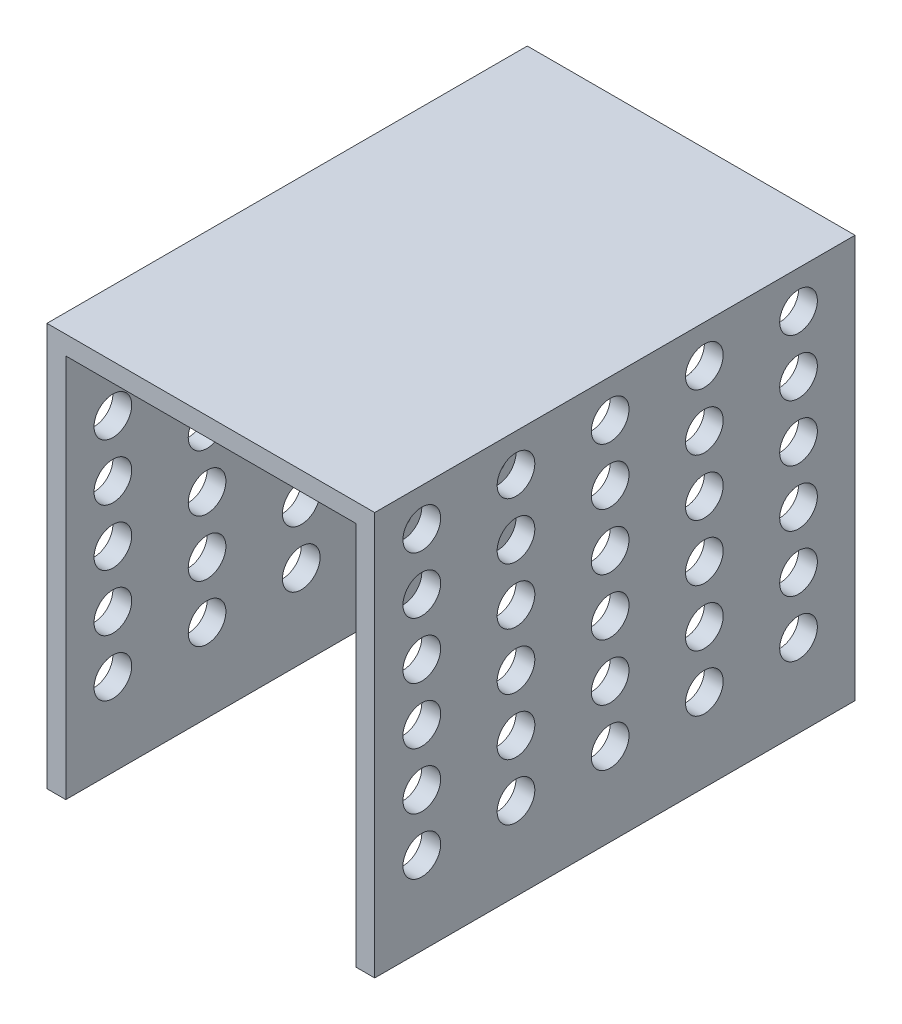
from build123d import *

# Parameters (mm, degrees)
EXTRUDE_1_DEPTH                   = 25.5
SKETCH_2_R                        = 1
CUT_EXTRUDE_1_DEPTH               = 27
PATTERN_LINEAR_1_COUNT            = 6
PATTERN_LINEAR_1_PITCH            = 3
PATTERN_LINEAR_2_COUNT            = 6
PATTERN_LINEAR_2_PITCH            = 5
PATTERN_LINEAR_2_COPY_1_SKETCH_R  = 1
PATTERN_LINEAR_2_COPY_1_DEPTH     = 27
PATTERN_LINEAR_2_COPY_2_SKETCH_R  = 1
PATTERN_LINEAR_2_COPY_2_DEPTH     = 27
PATTERN_LINEAR_2_COPY_3_SKETCH_R  = 1
PATTERN_LINEAR_2_COPY_3_DEPTH     = 27
PATTERN_LINEAR_2_COPY_4_SKETCH_R  = 1
PATTERN_LINEAR_2_COPY_4_DEPTH     = 27
PATTERN_LINEAR_2_COPY_5_SKETCH_R  = 1
PATTERN_LINEAR_2_COPY_5_DEPTH     = 27
PATTERN_LINEAR_2_COPY_6_SKETCH_R  = 1
PATTERN_LINEAR_2_COPY_6_DEPTH     = 27
PATTERN_LINEAR_2_COPY_7_SKETCH_R  = 1
PATTERN_LINEAR_2_COPY_7_DEPTH     = 27
PATTERN_LINEAR_2_COPY_8_SKETCH_R  = 1
PATTERN_LINEAR_2_COPY_8_DEPTH     = 27
PATTERN_LINEAR_2_COPY_9_SKETCH_R  = 1
PATTERN_LINEAR_2_COPY_9_DEPTH     = 27
PATTERN_LINEAR_2_COPY_10_SKETCH_R = 1
PATTERN_LINEAR_2_COPY_10_DEPTH    = 27
PATTERN_LINEAR_2_COPY_11_SKETCH_R = 1
PATTERN_LINEAR_2_COPY_11_DEPTH    = 27
PATTERN_LINEAR_2_COPY_12_SKETCH_R = 1
PATTERN_LINEAR_2_COPY_12_DEPTH    = 27
PATTERN_LINEAR_2_COPY_13_SKETCH_R = 1
PATTERN_LINEAR_2_COPY_13_DEPTH    = 27
PATTERN_LINEAR_2_COPY_14_SKETCH_R = 1
PATTERN_LINEAR_2_COPY_14_DEPTH    = 27
PATTERN_LINEAR_2_COPY_15_SKETCH_R = 1
PATTERN_LINEAR_2_COPY_15_DEPTH    = 27
PATTERN_LINEAR_2_COPY_16_SKETCH_R = 1
PATTERN_LINEAR_2_COPY_16_DEPTH    = 27
PATTERN_LINEAR_2_COPY_17_SKETCH_R = 1
PATTERN_LINEAR_2_COPY_17_DEPTH    = 27
PATTERN_LINEAR_2_COPY_18_SKETCH_R = 1
PATTERN_LINEAR_2_COPY_18_DEPTH    = 27
PATTERN_LINEAR_2_COPY_19_SKETCH_R = 1
PATTERN_LINEAR_2_COPY_19_DEPTH    = 27
PATTERN_LINEAR_2_COPY_20_SKETCH_R = 1
PATTERN_LINEAR_2_COPY_20_DEPTH    = 27
PATTERN_LINEAR_2_COPY_21_SKETCH_R = 1
PATTERN_LINEAR_2_COPY_21_DEPTH    = 27
PATTERN_LINEAR_2_COPY_22_SKETCH_R = 1
PATTERN_LINEAR_2_COPY_22_DEPTH    = 27
PATTERN_LINEAR_2_COPY_23_SKETCH_R = 1
PATTERN_LINEAR_2_COPY_23_DEPTH    = 27
PATTERN_LINEAR_2_COPY_24_SKETCH_R = 1
PATTERN_LINEAR_2_COPY_24_DEPTH    = 27
PATTERN_LINEAR_2_COPY_25_SKETCH_R = 1
PATTERN_LINEAR_2_COPY_25_DEPTH    = 27


with BuildPart() as part:
    # 草图1 → 凸台-拉伸1 (new body)
    with BuildSketch(Plane.XY):
        Polygon((-8.7, 10.7), (8.7, 10.7), (8.7, -10.7), (7.7, -10.7), (7.7, 9.7), (-7.7, 9.7), (-7.7, -10.7), (-8.7, -10.7), align=None)
    extrude(amount=EXTRUDE_1_DEPTH)

    # 草图2 → 切除-拉伸1 (cut)
    with BuildSketch(Plane.ZY.offset(8.7)):
        with Locations(Location((3, 8.7, 0), (0, 0, 90))):
            Circle(SKETCH_2_R)
    cut_extrude_1 = extrude(amount=-CUT_EXTRUDE_1_DEPTH, mode=Mode.SUBTRACT)

    # 阵列(线性)1: 切除-拉伸1 ×6
    with Locations(*[(0, -i * PATTERN_LINEAR_1_PITCH, 0) for i in range(1, PATTERN_LINEAR_1_COUNT)]):
        add(cut_extrude_1, mode=Mode.SUBTRACT)

    # 阵列(线性)2: 切除-拉伸1 ×6
    with Locations(*[(0, 0, i * PATTERN_LINEAR_2_PITCH) for i in range(1, PATTERN_LINEAR_2_COUNT)]):
        add(cut_extrude_1, mode=Mode.SUBTRACT)

    # 阵列(线性)2 copy 1 sketch → 阵列(线性)2 copy 1 (cut)
    with BuildSketch(Plane(origin=(-8.7, -3, 5), x_dir=(0, 0, 1), z_dir=(-1, 0, 0))):
        with Locations(Location((3, 8.7, 0), (0, 0, 90))):
            Circle(PATTERN_LINEAR_2_COPY_1_SKETCH_R)
    extrude(amount=-PATTERN_LINEAR_2_COPY_1_DEPTH, mode=Mode.SUBTRACT)

    # 阵列(线性)2 copy 2 sketch → 阵列(线性)2 copy 2 (cut)
    with BuildSketch(Plane(origin=(-8.7, -3, 10), x_dir=(0, 0, 1), z_dir=(-1, 0, 0))):
        with Locations(Location((3, 8.7, 0), (0, 0, 90))):
            Circle(PATTERN_LINEAR_2_COPY_2_SKETCH_R)
    extrude(amount=-PATTERN_LINEAR_2_COPY_2_DEPTH, mode=Mode.SUBTRACT)

    # 阵列(线性)2 copy 3 sketch → 阵列(线性)2 copy 3 (cut)
    with BuildSketch(Plane(origin=(-8.7, -3, 15), x_dir=(0, 0, 1), z_dir=(-1, 0, 0))):
        with Locations(Location((3, 8.7, 0), (0, 0, 90))):
            Circle(PATTERN_LINEAR_2_COPY_3_SKETCH_R)
    extrude(amount=-PATTERN_LINEAR_2_COPY_3_DEPTH, mode=Mode.SUBTRACT)

    # 阵列(线性)2 copy 4 sketch → 阵列(线性)2 copy 4 (cut)
    with BuildSketch(Plane(origin=(-8.7, -3, 20), x_dir=(0, 0, 1), z_dir=(-1, 0, 0))):
        with Locations(Location((3, 8.7, 0), (0, 0, 90))):
            Circle(PATTERN_LINEAR_2_COPY_4_SKETCH_R)
    extrude(amount=-PATTERN_LINEAR_2_COPY_4_DEPTH, mode=Mode.SUBTRACT)

    # 阵列(线性)2 copy 5 sketch → 阵列(线性)2 copy 5 (cut)
    with BuildSketch(Plane(origin=(-8.7, -3, 25), x_dir=(0, 0, 1), z_dir=(-1, 0, 0))):
        with Locations(Location((3, 8.7, 0), (0, 0, 90))):
            Circle(PATTERN_LINEAR_2_COPY_5_SKETCH_R)
    extrude(amount=-PATTERN_LINEAR_2_COPY_5_DEPTH, mode=Mode.SUBTRACT)

    # 阵列(线性)2 copy 6 sketch → 阵列(线性)2 copy 6 (cut)
    with BuildSketch(Plane(origin=(-8.7, -6, 5), x_dir=(0, 0, 1), z_dir=(-1, 0, 0))):
        with Locations(Location((3, 8.7, 0), (0, 0, 90))):
            Circle(PATTERN_LINEAR_2_COPY_6_SKETCH_R)
    extrude(amount=-PATTERN_LINEAR_2_COPY_6_DEPTH, mode=Mode.SUBTRACT)

    # 阵列(线性)2 copy 7 sketch → 阵列(线性)2 copy 7 (cut)
    with BuildSketch(Plane(origin=(-8.7, -6, 10), x_dir=(0, 0, 1), z_dir=(-1, 0, 0))):
        with Locations(Location((3, 8.7, 0), (0, 0, 90))):
            Circle(PATTERN_LINEAR_2_COPY_7_SKETCH_R)
    extrude(amount=-PATTERN_LINEAR_2_COPY_7_DEPTH, mode=Mode.SUBTRACT)

    # 阵列(线性)2 copy 8 sketch → 阵列(线性)2 copy 8 (cut)
    with BuildSketch(Plane(origin=(-8.7, -6, 15), x_dir=(0, 0, 1), z_dir=(-1, 0, 0))):
        with Locations(Location((3, 8.7, 0), (0, 0, 90))):
            Circle(PATTERN_LINEAR_2_COPY_8_SKETCH_R)
    extrude(amount=-PATTERN_LINEAR_2_COPY_8_DEPTH, mode=Mode.SUBTRACT)

    # 阵列(线性)2 copy 9 sketch → 阵列(线性)2 copy 9 (cut)
    with BuildSketch(Plane(origin=(-8.7, -6, 20), x_dir=(0, 0, 1), z_dir=(-1, 0, 0))):
        with Locations(Location((3, 8.7, 0), (0, 0, 90))):
            Circle(PATTERN_LINEAR_2_COPY_9_SKETCH_R)
    extrude(amount=-PATTERN_LINEAR_2_COPY_9_DEPTH, mode=Mode.SUBTRACT)

    # 阵列(线性)2 copy 10 sketch → 阵列(线性)2 copy 10 (cut)
    with BuildSketch(Plane(origin=(-8.7, -6, 25), x_dir=(0, 0, 1), z_dir=(-1, 0, 0))):
        with Locations(Location((3, 8.7, 0), (0, 0, 90))):
            Circle(PATTERN_LINEAR_2_COPY_10_SKETCH_R)
    extrude(amount=-PATTERN_LINEAR_2_COPY_10_DEPTH, mode=Mode.SUBTRACT)

    # 阵列(线性)2 copy 11 sketch → 阵列(线性)2 copy 11 (cut)
    with BuildSketch(Plane(origin=(-8.7, -9, 5), x_dir=(0, 0, 1), z_dir=(-1, 0, 0))):
        with Locations(Location((3, 8.7, 0), (0, 0, 90))):
            Circle(PATTERN_LINEAR_2_COPY_11_SKETCH_R)
    extrude(amount=-PATTERN_LINEAR_2_COPY_11_DEPTH, mode=Mode.SUBTRACT)

    # 阵列(线性)2 copy 12 sketch → 阵列(线性)2 copy 12 (cut)
    with BuildSketch(Plane(origin=(-8.7, -9, 10), x_dir=(0, 0, 1), z_dir=(-1, 0, 0))):
        with Locations(Location((3, 8.7, 0), (0, 0, 90))):
            Circle(PATTERN_LINEAR_2_COPY_12_SKETCH_R)
    extrude(amount=-PATTERN_LINEAR_2_COPY_12_DEPTH, mode=Mode.SUBTRACT)

    # 阵列(线性)2 copy 13 sketch → 阵列(线性)2 copy 13 (cut)
    with BuildSketch(Plane(origin=(-8.7, -9, 15), x_dir=(0, 0, 1), z_dir=(-1, 0, 0))):
        with Locations(Location((3, 8.7, 0), (0, 0, 90))):
            Circle(PATTERN_LINEAR_2_COPY_13_SKETCH_R)
    extrude(amount=-PATTERN_LINEAR_2_COPY_13_DEPTH, mode=Mode.SUBTRACT)

    # 阵列(线性)2 copy 14 sketch → 阵列(线性)2 copy 14 (cut)
    with BuildSketch(Plane(origin=(-8.7, -9, 20), x_dir=(0, 0, 1), z_dir=(-1, 0, 0))):
        with Locations(Location((3, 8.7, 0), (0, 0, 90))):
            Circle(PATTERN_LINEAR_2_COPY_14_SKETCH_R)
    extrude(amount=-PATTERN_LINEAR_2_COPY_14_DEPTH, mode=Mode.SUBTRACT)

    # 阵列(线性)2 copy 15 sketch → 阵列(线性)2 copy 15 (cut)
    with BuildSketch(Plane(origin=(-8.7, -9, 25), x_dir=(0, 0, 1), z_dir=(-1, 0, 0))):
        with Locations(Location((3, 8.7, 0), (0, 0, 90))):
            Circle(PATTERN_LINEAR_2_COPY_15_SKETCH_R)
    extrude(amount=-PATTERN_LINEAR_2_COPY_15_DEPTH, mode=Mode.SUBTRACT)

    # 阵列(线性)2 copy 16 sketch → 阵列(线性)2 copy 16 (cut)
    with BuildSketch(Plane(origin=(-8.7, -12, 5), x_dir=(0, 0, 1), z_dir=(-1, 0, 0))):
        with Locations(Location((3, 8.7, 0), (0, 0, 90))):
            Circle(PATTERN_LINEAR_2_COPY_16_SKETCH_R)
    extrude(amount=-PATTERN_LINEAR_2_COPY_16_DEPTH, mode=Mode.SUBTRACT)

    # 阵列(线性)2 copy 17 sketch → 阵列(线性)2 copy 17 (cut)
    with BuildSketch(Plane(origin=(-8.7, -12, 10), x_dir=(0, 0, 1), z_dir=(-1, 0, 0))):
        with Locations(Location((3, 8.7, 0), (0, 0, 90))):
            Circle(PATTERN_LINEAR_2_COPY_17_SKETCH_R)
    extrude(amount=-PATTERN_LINEAR_2_COPY_17_DEPTH, mode=Mode.SUBTRACT)

    # 阵列(线性)2 copy 18 sketch → 阵列(线性)2 copy 18 (cut)
    with BuildSketch(Plane(origin=(-8.7, -12, 15), x_dir=(0, 0, 1), z_dir=(-1, 0, 0))):
        with Locations(Location((3, 8.7, 0), (0, 0, 90))):
            Circle(PATTERN_LINEAR_2_COPY_18_SKETCH_R)
    extrude(amount=-PATTERN_LINEAR_2_COPY_18_DEPTH, mode=Mode.SUBTRACT)

    # 阵列(线性)2 copy 19 sketch → 阵列(线性)2 copy 19 (cut)
    with BuildSketch(Plane(origin=(-8.7, -12, 20), x_dir=(0, 0, 1), z_dir=(-1, 0, 0))):
        with Locations(Location((3, 8.7, 0), (0, 0, 90))):
            Circle(PATTERN_LINEAR_2_COPY_19_SKETCH_R)
    extrude(amount=-PATTERN_LINEAR_2_COPY_19_DEPTH, mode=Mode.SUBTRACT)

    # 阵列(线性)2 copy 20 sketch → 阵列(线性)2 copy 20 (cut)
    with BuildSketch(Plane(origin=(-8.7, -12, 25), x_dir=(0, 0, 1), z_dir=(-1, 0, 0))):
        with Locations(Location((3, 8.7, 0), (0, 0, 90))):
            Circle(PATTERN_LINEAR_2_COPY_20_SKETCH_R)
    extrude(amount=-PATTERN_LINEAR_2_COPY_20_DEPTH, mode=Mode.SUBTRACT)

    # 阵列(线性)2 copy 21 sketch → 阵列(线性)2 copy 21 (cut)
    with BuildSketch(Plane(origin=(-8.7, -15, 5), x_dir=(0, 0, 1), z_dir=(-1, 0, 0))):
        with Locations(Location((3, 8.7, 0), (0, 0, 90))):
            Circle(PATTERN_LINEAR_2_COPY_21_SKETCH_R)
    extrude(amount=-PATTERN_LINEAR_2_COPY_21_DEPTH, mode=Mode.SUBTRACT)

    # 阵列(线性)2 copy 22 sketch → 阵列(线性)2 copy 22 (cut)
    with BuildSketch(Plane(origin=(-8.7, -15, 10), x_dir=(0, 0, 1), z_dir=(-1, 0, 0))):
        with Locations(Location((3, 8.7, 0), (0, 0, 90))):
            Circle(PATTERN_LINEAR_2_COPY_22_SKETCH_R)
    extrude(amount=-PATTERN_LINEAR_2_COPY_22_DEPTH, mode=Mode.SUBTRACT)

    # 阵列(线性)2 copy 23 sketch → 阵列(线性)2 copy 23 (cut)
    with BuildSketch(Plane(origin=(-8.7, -15, 15), x_dir=(0, 0, 1), z_dir=(-1, 0, 0))):
        with Locations(Location((3, 8.7, 0), (0, 0, 90))):
            Circle(PATTERN_LINEAR_2_COPY_23_SKETCH_R)
    extrude(amount=-PATTERN_LINEAR_2_COPY_23_DEPTH, mode=Mode.SUBTRACT)

    # 阵列(线性)2 copy 24 sketch → 阵列(线性)2 copy 24 (cut)
    with BuildSketch(Plane(origin=(-8.7, -15, 20), x_dir=(0, 0, 1), z_dir=(-1, 0, 0))):
        with Locations(Location((3, 8.7, 0), (0, 0, 90))):
            Circle(PATTERN_LINEAR_2_COPY_24_SKETCH_R)
    extrude(amount=-PATTERN_LINEAR_2_COPY_24_DEPTH, mode=Mode.SUBTRACT)

    # 阵列(线性)2 copy 25 sketch → 阵列(线性)2 copy 25 (cut)
    with BuildSketch(Plane(origin=(-8.7, -15, 25), x_dir=(0, 0, 1), z_dir=(-1, 0, 0))):
        with Locations(Location((3, 8.7, 0), (0, 0, 90))):
            Circle(PATTERN_LINEAR_2_COPY_25_SKETCH_R)
    extrude(amount=-PATTERN_LINEAR_2_COPY_25_DEPTH, mode=Mode.SUBTRACT)


solid = part.part
